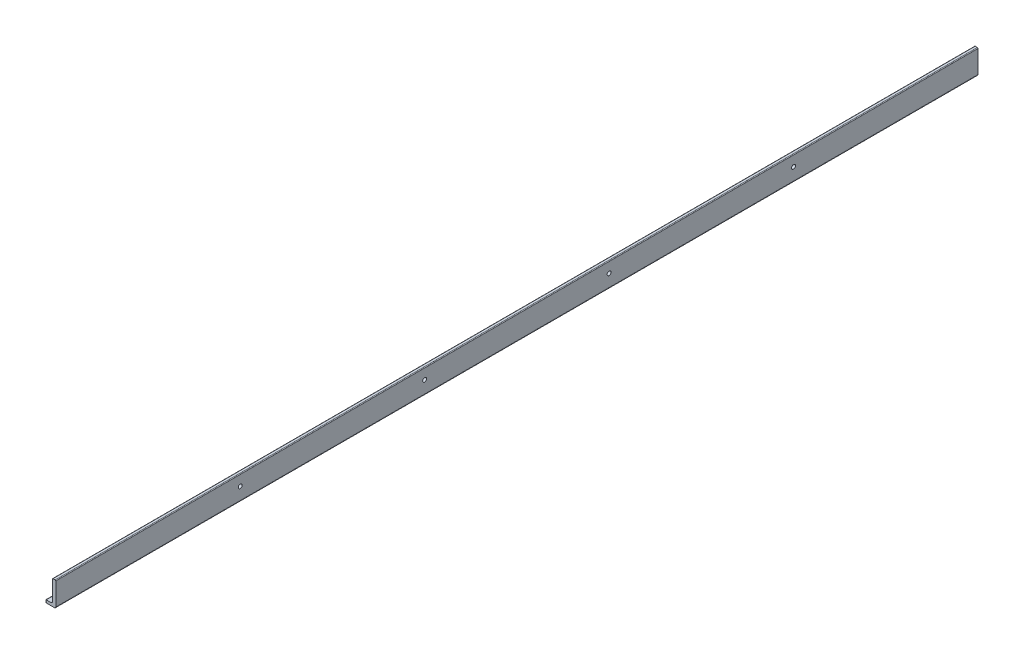
from build123d import *

# Parameters (mm, degrees)
EXTRUDE_1_DEPTH      = 680
HOLE_WIZARD_M3_5_1_D = 2.9
FILLET_1_R           = 1
FILLET_2_R           = 0.5


with BuildPart() as part:
    # 草图1 → 凸台-拉伸1 (new body)
    with BuildSketch(Plane.XY):
        Polygon((0, 0), (0, 18), (-2.5, 18), (-2.5, 2), (-7.5, 2), (-7.5, 0), align=None)
    extrude(amount=EXTRUDE_1_DEPTH)

    # M3.5 螺纹孔1 (through all)
    with Locations(Plane.ZY.offset(2.5)):
        with Locations((136, 10), (272, 10), (408, 10), (544, 10)):
            Hole(HOLE_WIZARD_M3_5_1_D / 2)

    # 圆角1
    fillet_1_edges = [part.edges().sort_by_distance(p)[0] for p in [
        (-2.5, 2, 340),
        (0, 0, 340),
    ]]
    fillet(fillet_1_edges, radius=FILLET_1_R)

    # 圆角2
    fillet_2_edges = [part.edges().sort_by_distance(p)[0] for p in [
        (-7.5, 0, 340),
        (-7.5, 2, 340),
        (-2.5, 18, 340),
        (0, 18, 340),
        (-7.5, 1, 680),
        (-7.5, 1, 0),
    ]]
    fillet(fillet_2_edges, radius=FILLET_2_R)


solid = part.part
